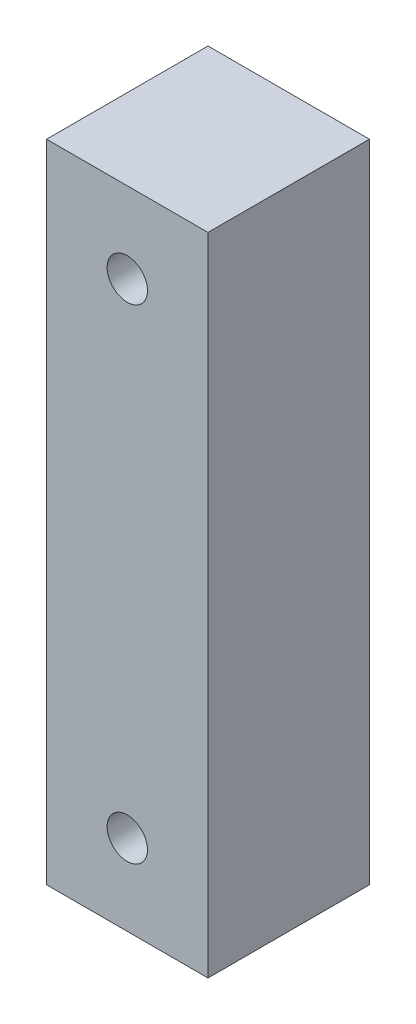
from build123d import *

# Parameters (mm, degrees)
SKETCH1_W           = 38.1
SKETCH1_H           = 152.4
BOSS_EXTRUDE1_DEPTH = 38.1
SKETCH2_R           = 4.7625
CUT_EXTRUDE1_DEPTH  = 162.644610179
SKETCH3_R           = 4.7625
CUT_EXTRUDE2_DEPTH  = 162.644610179


with BuildPart() as part:
    # Sketch1 → Boss-Extrude1 (new body)
    with BuildSketch(Plane.XY):
        with Locations((19.05, 76.2)):
            Rectangle(SKETCH1_W, SKETCH1_H)
    extrude(amount=BOSS_EXTRUDE1_DEPTH)

    # Sketch2 → Cut-Extrude1 (cut, through all)
    with BuildSketch(Plane.XY.offset(38.1)):
        with Locations((19.05, 133.35)):
            Circle(SKETCH2_R)
    extrude(amount=-CUT_EXTRUDE1_DEPTH, mode=Mode.SUBTRACT)

    # Sketch3 → Cut-Extrude2 (cut, through all)
    with BuildSketch(Plane.XY.offset(38.1)):
        with Locations((19.05, 19.05)):
            Circle(SKETCH3_R)
    extrude(amount=-CUT_EXTRUDE2_DEPTH, mode=Mode.SUBTRACT)


solid = part.part
